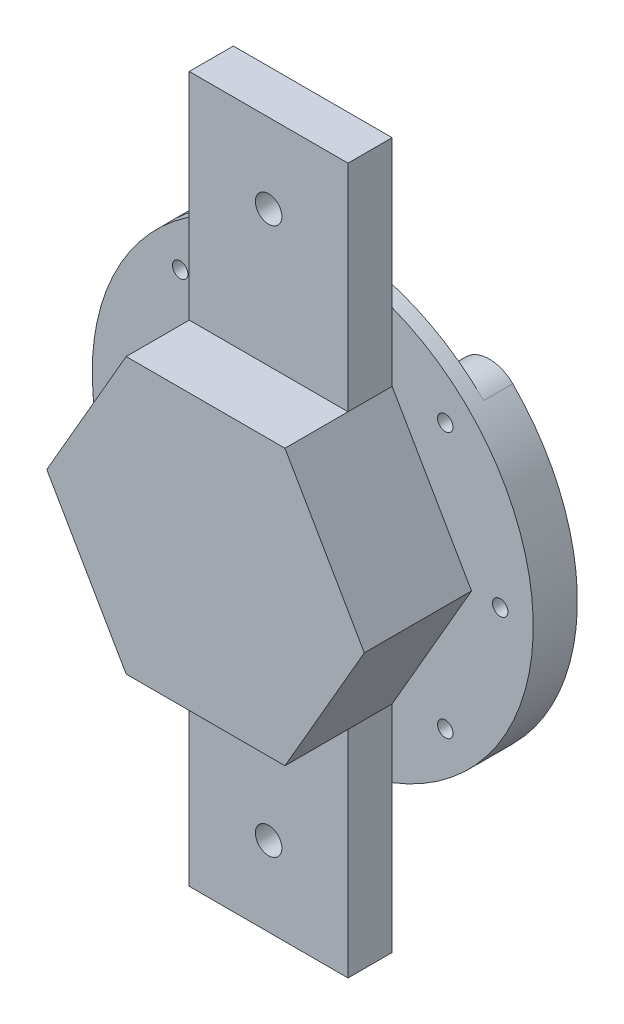
from build123d import *

# Parameters (mm, degrees)
SKETCH_1_R          = 1.75
EXTRUDE_1_DEPTH     = 6.6
EXTRUDE_1_2_DEPTH   = 6.6
SKETCH_2_R          = 50
EXTRUDE_2_DEPTH     = 3.4
SKETCH_4_R          = 1.75
CUT_EXTRUDE_2_DEPTH = 10
EXTRUDE_7_DEPTH     = 20
SKETCH_10_W         = 36
SKETCH_10_H         = 48.823085464
CUT_EXTRUDE_3_DEPTH = 10
SKETCH_11_R         = 3
CUT_EXTRUDE_6_DEPTH = 10
EXTRUDE_8_DEPTH     = 4.3


with BuildPart() as part:
    # 草图1 → 凸台-拉伸1 (new body)
    with BuildSketch(Plane.XY):
        with BuildLine():
            ThreePointArc((20.506096654, 20.506096654), (29, 0), (20.506096654, -20.506096654))
            Line((20.506096654, -20.506096654), (24.748737342, -24.748737342))
            ThreePointArc((24.748737342, -24.748737342), (24.748737342, -35.355339059), (35.355339059, -35.355339059))
            ThreePointArc((35.355339059, -35.355339059), (50, 0), (35.355339059, 35.355339059))
            ThreePointArc((35.355339059, 35.355339059), (24.748737342, 35.355339059), (24.748737342, 24.748737342))
            Line((24.748737342, 24.748737342), (20.506096654, 20.506096654))
        make_face()
        with Locations((30.0520382, 30.0520382)):
            Circle(SKETCH_1_R, mode=Mode.SUBTRACT)
        with Locations((30.0520382, -30.0520382)):
            Circle(SKETCH_1_R, mode=Mode.SUBTRACT)
        with Locations((42.5, 0)):
            Circle(SKETCH_1_R, mode=Mode.SUBTRACT)
    extrude(amount=EXTRUDE_1_DEPTH)



with BuildPart() as body_2:
    # 草图1 → Extrude 1 2 (new body)
    with BuildSketch(Plane.XY):
        with BuildLine():
            ThreePointArc((-35.355339059, 35.355339059), (-50, 0), (-35.355339059, -35.355339059))
            ThreePointArc((-35.355339059, -35.355339059), (-24.748737342, -35.355339059), (-24.748737342, -24.748737342))
            Line((-24.748737342, -24.748737342), (-20.506096654, -20.506096654))
            ThreePointArc((-20.506096654, -20.506096654), (-29, 0), (-20.506096654, 20.506096654))
            Line((-20.506096654, 20.506096654), (-24.748737342, 24.748737342))
            ThreePointArc((-24.748737342, 24.748737342), (-24.748737342, 35.355339059), (-35.355339059, 35.355339059))
        make_face()
        with Locations((-30.0520382, 30.0520382)):
            Circle(SKETCH_1_R, mode=Mode.SUBTRACT)
        with Locations((-30.0520382, -30.0520382)):
            Circle(SKETCH_1_R, mode=Mode.SUBTRACT)
        with Locations((-42.5, 0)):
            Circle(SKETCH_1_R, mode=Mode.SUBTRACT)
    extrude(amount=EXTRUDE_1_2_DEPTH)


with BuildPart() as part_1:
    add(part.part)

    add(body_2.part)  # 凸台-拉伸2 merges body 2
    # 草图2 → 凸台-拉伸2 (add)
    with BuildSketch(Plane.XY.offset(6.6)):
        with Locations(Location((0, 0, 0), (0, 0, 225))):
            Circle(SKETCH_2_R)
    extrude(amount=EXTRUDE_2_DEPTH)

    # 草图4 → 切除-拉伸2 (cut, symmetric)
    with BuildSketch(Plane(origin=(0, 0, 6.6), x_dir=(-1, 0, 0), z_dir=(0, 0, -1))):
        with Locations(Location((-42.5, 0, 0), (0, 0, 180))):
            Circle(SKETCH_4_R)
        with Locations(Location((-30.0520382, 30.0520382, 0), (0, 0, 180))):
            Circle(SKETCH_4_R)
        with Locations(Location((-30.0520382, -30.0520382, 0), (0, 0, 180))):
            Circle(SKETCH_4_R)
        with Locations(Location((30.0520382, -30.0520382, 0), (0, 0, 180))):
            Circle(SKETCH_4_R)
        with Locations(Location((42.5, 0, 0), (0, 0, 180))):
            Circle(SKETCH_4_R)
        with Locations(Location((30.0520382, 30.0520382, 0), (0, 0, 180))):
            Circle(SKETCH_4_R)
    extrude(amount=CUT_EXTRUDE_2_DEPTH, both=True, mode=Mode.SUBTRACT)

    # 草图5 → 凸台-拉伸7 (add)
    with BuildSketch(Plane.XY.offset(10)):
        Polygon((-18, -31.176914536), (-18, -80), (18, -80), (18, -31.176914536), (36, 0), (18, 31.176914536), (18, 80), (-18, 80), (-18, 31.176914536), (-36, 0), align=None)
    extrude(amount=EXTRUDE_7_DEPTH)

    # 草图10 → 切除-拉伸3 (cut)
    with BuildSketch(Plane.XY.offset(30)):
        with Locations((0, -55.588457268)):
            Rectangle(SKETCH_10_W, SKETCH_10_H)
        with Locations((0, 55.588457268)):
            Rectangle(SKETCH_10_W, SKETCH_10_H)
    extrude(amount=-CUT_EXTRUDE_3_DEPTH, mode=Mode.SUBTRACT)

    # 草图11 → 切除-拉伸6 (cut)
    with BuildSketch(Plane.XY.offset(20)):
        with Locations((0, 62)):
            Circle(SKETCH_11_R)
    cut_extrude_6 = extrude(amount=-CUT_EXTRUDE_6_DEPTH, mode=Mode.SUBTRACT)

    # 镜向2: 切除-拉伸6 across plane
    add(cut_extrude_6.mirror(Plane.ZX), mode=Mode.SUBTRACT)

    # 草图12 → 凸台-拉伸8 (add)
    with BuildSketch(Plane.XY.offset(30)):
        Polygon((36, 0), (18, 31.176914536), (-18, 31.176914536), (-36, 0), (-18, -31.176914536), (18, -31.176914536), align=None)
    extrude(amount=EXTRUDE_8_DEPTH)


solid = part_1.part
